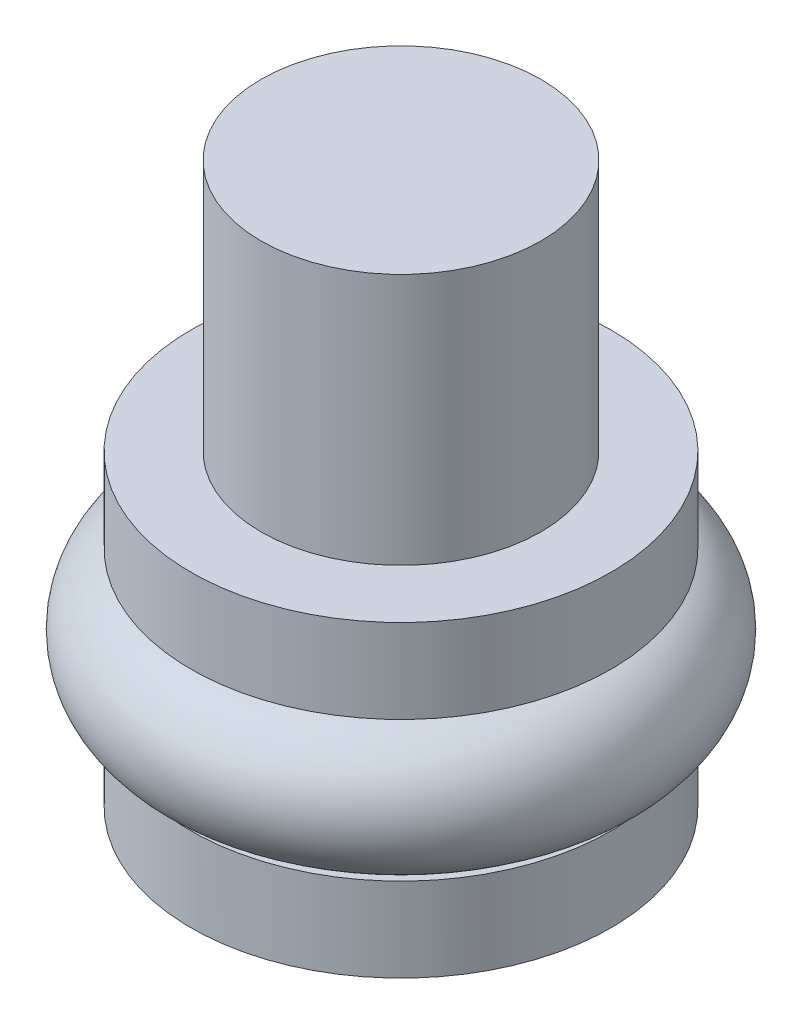
from build123d import *

# Parameters (mm, degrees)
SKETCH1_R           = 5
BOSS_EXTRUDE1_DEPTH = 9
SKETCH2_R           = 7.5
BOSS_EXTRUDE2_DEPTH = 3
SKETCH5_R           = 2.461110706
SKETCH12_R          = 7.5
BOSS_EXTRUDE3_DEPTH = 3


with BuildPart() as part:
    # Sketch1 → Boss-Extrude1 (new body)
    with BuildSketch(Plane(origin=(0, 0, 0), x_dir=(1, 0, 0), z_dir=(0, 1, 0))):
        with Locations(Location((0, 0, 0), (0, 0, 270))):
            Circle(SKETCH1_R)
    extrude(amount=BOSS_EXTRUDE1_DEPTH)

    # Sketch2 → Boss-Extrude2 (add)
    with BuildSketch(Plane(origin=(0, 0, 0), x_dir=(-1, 0, 0), z_dir=(0, -1, 0))):
        with Locations(Location((0, 0, 0), (0, 0, 90))):
            Circle(SKETCH2_R)
    extrude(amount=BOSS_EXTRUDE2_DEPTH)


with BuildPart() as body_2:
    # Sweep1: sweep along a path in Sketch3
    with BuildLine(Plane(origin=(0, -5.5, 0), x_dir=(-1, 0, 0), z_dir=(0, -1, 0))) as sweep1_path:
        CenterArc((0, 0), 6.5, 0, 360)
    # Sketch5 → Sweep1 (sweep)
    with BuildSketch(Plane(origin=(0, 0, 0), x_dir=(0, 0, -1), z_dir=(1, 0, 0))):
        with Locations((-6.5, -5.5)):
            Circle(SKETCH5_R)
    sweep(path=sweep1_path.line)


with BuildPart() as body_3:
    # Sketch12 → Boss-Extrude3 (new body)
    with BuildSketch(Plane(origin=(0, -8, 0), x_dir=(-1, 0, 0), z_dir=(0, -1, 0))):
        with Locations(Location((0, 0, 0), (0, 0, 90))):
            Circle(SKETCH12_R)
    extrude(amount=BOSS_EXTRUDE3_DEPTH)

    # Sketch13 → Revolve1 (revolve)
    with BuildSketch(Plane.XY, mode=Mode.PRIVATE) as revolve1_sk:
        Polygon((0, -11), (0, -13), (7.5, -11), align=None)
    revolve(revolve1_sk.sketch.rotate(Axis((0, -11, 0), (0, -1, 0)), 180), axis=Axis((0, -11, 0), (0, -1, 0)))


solid = Compound([part.part, body_2.part, body_3.part])
